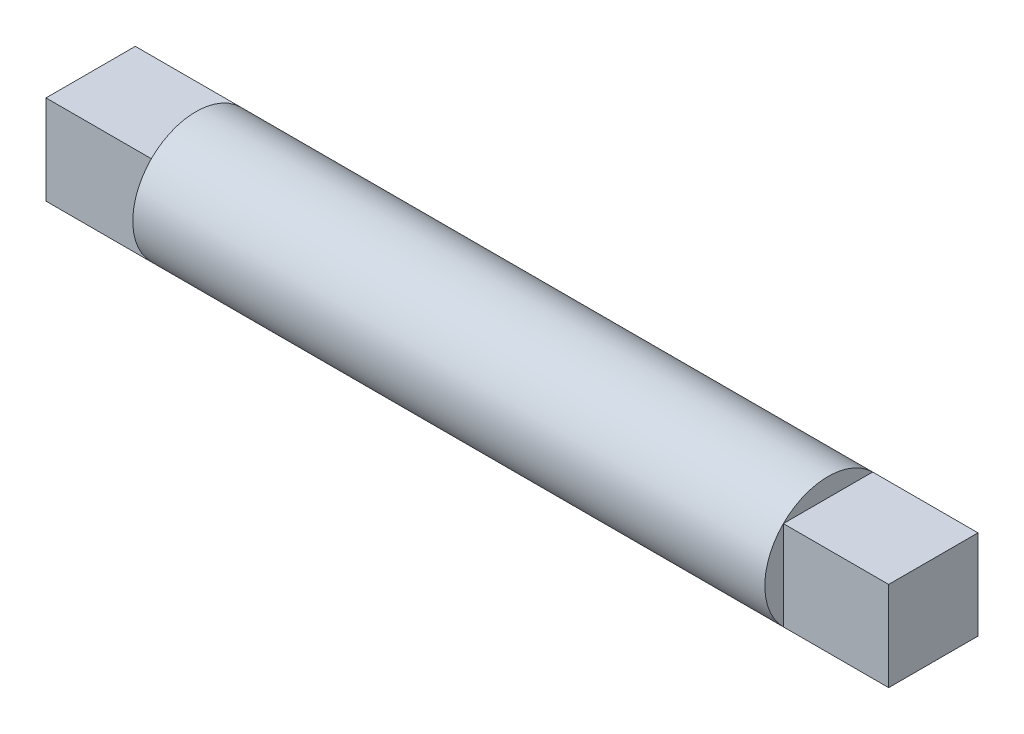
from build123d import *

# Parameters (mm, degrees)
SKETCH1_R           = 3
BOSS_EXTRUDE1_DEPTH = 15
SKETCH2_W           = 4.24
SKETCH2_H           = 4.245279732
BOSS_EXTRUDE2_DEPTH = 5


with BuildPart() as part:
    # Sketch1 → Boss-Extrude1 (new body)
    with BuildSketch(Plane(origin=(0, 0, 0), x_dir=(0, 0, -1), z_dir=(1, 0, 0))):
        Circle(SKETCH1_R)
    boss_extrude1 = extrude(amount=BOSS_EXTRUDE1_DEPTH)

    # Sketch2 → Boss-Extrude2 (add)
    with BuildSketch(Plane(origin=(15, 0, 0), x_dir=(0, 0, -1), z_dir=(1, 0, 0))):
        Rectangle(SKETCH2_W, SKETCH2_H)
    boss_extrude2 = extrude(amount=BOSS_EXTRUDE2_DEPTH)

    # Mirror1: Boss-Extrude1, Boss-Extrude2 across plane
    add(boss_extrude1.mirror(Plane(origin=(0, 0, 0), x_dir=(0, 0, 1), z_dir=(1, 0, 0))))
    add(boss_extrude2.mirror(Plane(origin=(0, 0, 0), x_dir=(0, 0, 1), z_dir=(1, 0, 0))))


solid = part.part
